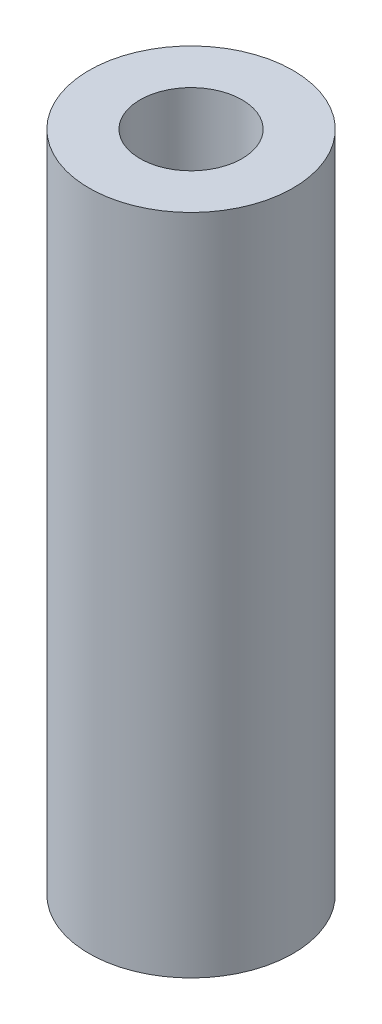
from build123d import *

# Parameters (mm, degrees)
SKETCH1_R           = 2
SKETCH1_R_2         = 1
BOSS_EXTRUDE1_DEPTH = 6.5


with BuildPart() as part:
    # Sketch1 → Boss-Extrude1 (new, symmetric)
    with BuildSketch(Plane(origin=(0, 0, 0), x_dir=(1, 0, 0), z_dir=(0, 1, 0))):
        with Locations(Location((0, 0, 0), (0, 0, 90))):
            Circle(SKETCH1_R)
        with Locations(Location((0, 0, 0), (0, 0, 90))):
            Circle(SKETCH1_R_2, mode=Mode.SUBTRACT)
    extrude(amount=BOSS_EXTRUDE1_DEPTH, both=True)


solid = part.part
